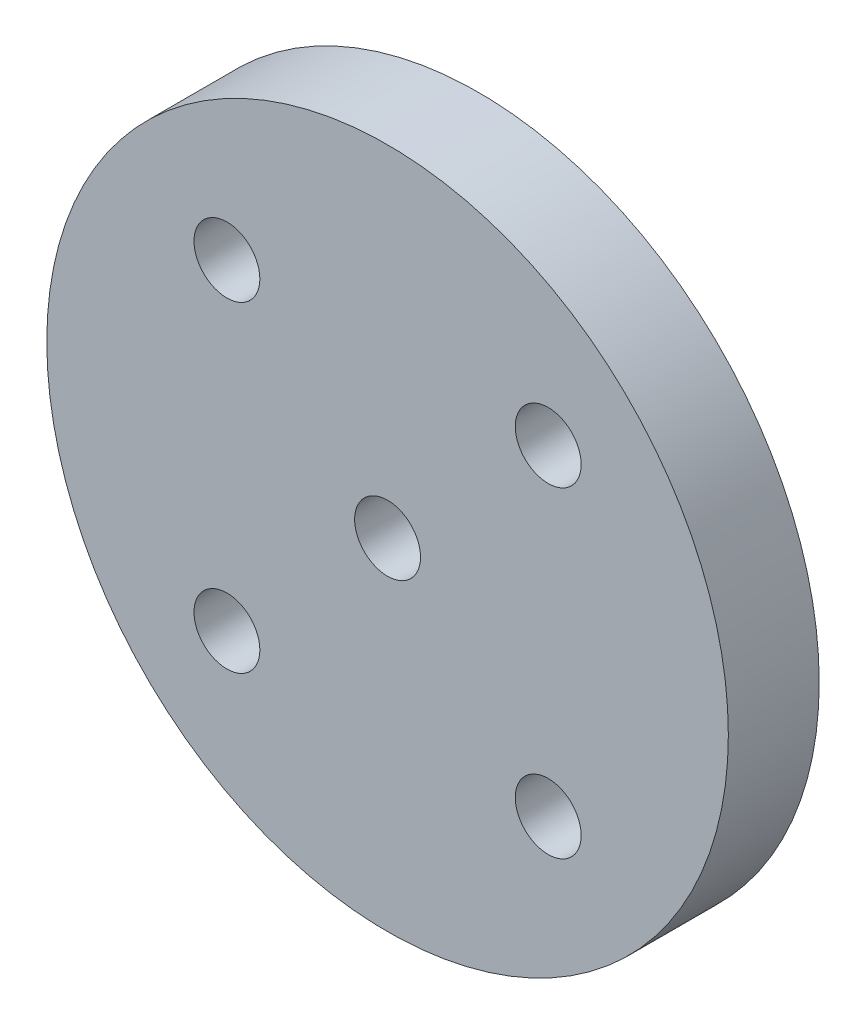
from build123d import *

# Parameters (mm, degrees)
SKETCH_1_R      = 15
SKETCH_1_R_2    = 1.45
EXTRUDE_1_DEPTH = 4


with BuildPart() as part:
    # 草图1 → 凸台-拉伸1 (new body)
    with BuildSketch(Plane.XY):
        Circle(SKETCH_1_R)
        Circle(SKETCH_1_R_2, mode=Mode.SUBTRACT)
        with Locations((-7.071067812, -7.071067812)):
            Circle(SKETCH_1_R_2, mode=Mode.SUBTRACT)
        with Locations((-7.071067812, 7.071067812)):
            Circle(SKETCH_1_R_2, mode=Mode.SUBTRACT)
        with Locations((7.071067812, 7.071067812)):
            Circle(SKETCH_1_R_2, mode=Mode.SUBTRACT)
        with Locations((7.071067812, -7.071067812)):
            Circle(SKETCH_1_R_2, mode=Mode.SUBTRACT)
    extrude(amount=EXTRUDE_1_DEPTH)


solid = part.part
